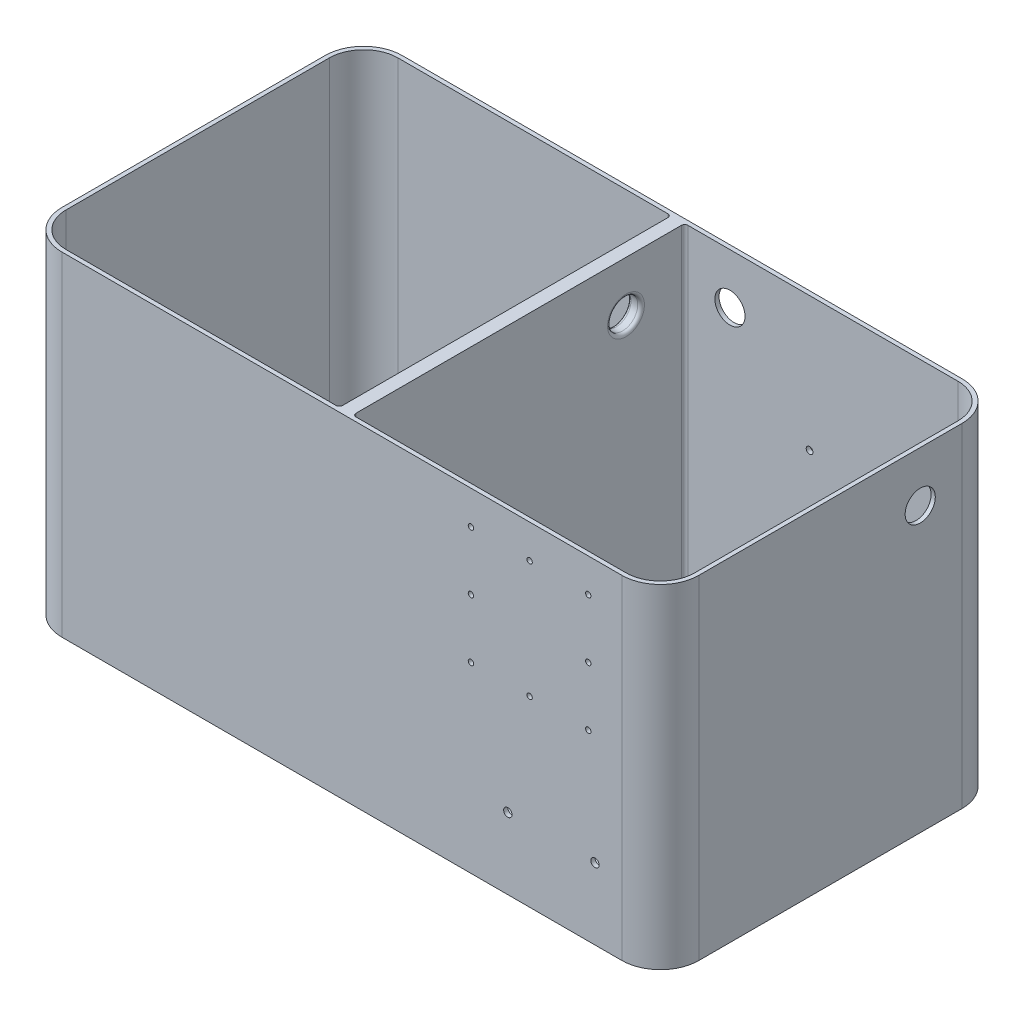
from build123d import *

# Parameters (mm, degrees)
EXTRUDE_1_DEPTH     = 199
CUT_EXTRUDE_1_DEPTH = 195
SKETCH_4_W          = 8
SKETCH_4_H          = 198
EXTRUDE_2_DEPTH     = 195
FILLET_1_R          = 2
CUT_EXTRUDE_2_REACH = 343.921
SKETCH_6_R          = 2
SKETCH_6_R_2        = 9
CUT_EXTRUDE_3_REACH = 297.87
SKETCH_7_R          = 9
FILLET_2_R          = 2
CUT_EXTRUDE_4_REACH = 442.798
SKETCH_9_R          = 9
CUT_EXTRUDE_5_REACH = 343.921
SKETCH_11_R         = 1.6
CUT_EXTRUDE_6_REACH = 343.921
SKETCH_12_R         = 1.6
CUT_EXTRUDE_7_REACH = 343.921
SKETCH_13_R         = 2.5


with BuildPart() as part:
    # 草图1 → 凸台-拉伸1 (new body)
    with BuildSketch(Plane(origin=(0, 0, 0), x_dir=(1, 0, 0), z_dir=(0, 1, 0))):
        with BuildLine():
            Line((-167, 101.5), (167, 101.5))
            ThreePointArc((167, 101.5), (183.263455967, 94.763455967), (190, 78.5))
            Line((190, 78.5), (190, -78.5))
            ThreePointArc((190, -78.5), (183.263455967, -94.763455967), (167, -101.5))
            Line((167, -101.5), (-167, -101.5))
            ThreePointArc((-167, -101.5), (-183.263455967, -94.763455967), (-190, -78.5))
            Line((-190, -78.5), (-190, 78.5))
            ThreePointArc((-190, 78.5), (-183.263455967, 94.763455967), (-167, 101.5))
        make_face()
    extrude(amount=EXTRUDE_1_DEPTH)

    # 草图3 → 切除-拉伸1 (cut)
    with BuildSketch(Plane(origin=(0, 199, 0), x_dir=(1, 0, 0), z_dir=(0, 1, 0))):
        with BuildLine():
            Line((-167, 99), (167, 99))
            ThreePointArc((167, 99), (181.495689014, 92.995689014), (187.5, 78.5))
            Line((187.5, 78.5), (187.5, -78.5))
            ThreePointArc((187.5, -78.5), (181.495689014, -92.995689014), (167, -99))
            Line((167, -99), (-167, -99))
            ThreePointArc((-167, -99), (-181.495689014, -92.995689014), (-187.5, -78.5))
            Line((-187.5, -78.5), (-187.5, 78.5))
            ThreePointArc((-187.5, 78.5), (-181.495689014, 92.995689014), (-167, 99))
        make_face()
    extrude(amount=-CUT_EXTRUDE_1_DEPTH, mode=Mode.SUBTRACT)

    # 草图4 → 凸台-拉伸2 (add)
    with BuildSketch(Plane(origin=(0, 4, 0), x_dir=(1, 0, 0), z_dir=(0, 1, 0))):
        Rectangle(SKETCH_4_W, SKETCH_4_H)
    extrude(amount=EXTRUDE_2_DEPTH)

    # 圆角1
    fillet_1_edges = [part.edges().sort_by_distance(p)[0] for p in [
        (-181.495689014, 4, 92.995689014),
        (-187.5, 4, 0),
        (-181.495689014, 4, -92.995689014),
        (85.5, 4, -99),
        (181.495689014, 4, -92.995689014),
        (187.5, 4, 0),
        (181.495689014, 4, 92.995689014),
        (-85.5, 4, 99),
        (85.5, 4, 99),
        (-85.5, 4, -99),
        (4, 101.5, -99),
        (-4, 4, 0),
        (-4, 101.5, -99),
        (-4, 101.5, 99),
        (4, 4, 0),
        (4, 101.5, 99),
    ]]
    fillet(fillet_1_edges, radius=FILLET_1_R)

    # 草图6 → 切除-拉伸2 (cut, up to next)
    with BuildSketch(Plane(origin=(0, 0, -101.5), x_dir=(-1, 0, 0), z_dir=(0, 0, -1)), mode=Mode.PRIVATE) as cut_extrude_2_sk1:
        with Locations((-155, 119)):
            Circle(SKETCH_6_R)
    cut_extrude_2_tool1 = extrude(cut_extrude_2_sk1.sketch, amount=-CUT_EXTRUDE_2_REACH, mode=Mode.PRIVATE) & part.part
    # 草图6 → 切除-拉伸2 (cut, up to next)
    with BuildSketch(Plane(origin=(0, 0, -101.5), x_dir=(-1, 0, 0), z_dir=(0, 0, -1)), mode=Mode.PRIVATE) as cut_extrude_2_sk2:
        with Locations((-155, 64)):
            Circle(SKETCH_6_R)
    cut_extrude_2_tool2 = extrude(cut_extrude_2_sk2.sketch, amount=-CUT_EXTRUDE_2_REACH, mode=Mode.PRIVATE) & part.part
    # 草图6 → 切除-拉伸2 (cut, up to next)
    with BuildSketch(Plane(origin=(0, 0, -101.5), x_dir=(-1, 0, 0), z_dir=(0, 0, -1)), mode=Mode.PRIVATE) as cut_extrude_2_sk3:
        with Locations((-78.5, 64)):
            Circle(SKETCH_6_R)
    cut_extrude_2_tool3 = extrude(cut_extrude_2_sk3.sketch, amount=-CUT_EXTRUDE_2_REACH, mode=Mode.PRIVATE) & part.part
    # 草图6 → 切除-拉伸2 (cut, up to next)
    with BuildSketch(Plane(origin=(0, 0, -101.5), x_dir=(-1, 0, 0), z_dir=(0, 0, -1)), mode=Mode.PRIVATE) as cut_extrude_2_sk4:
        with Locations((-78.5, 119)):
            Circle(SKETCH_6_R)
    cut_extrude_2_tool4 = extrude(cut_extrude_2_sk4.sketch, amount=-CUT_EXTRUDE_2_REACH, mode=Mode.PRIVATE) & part.part
    # 草图6 → 切除-拉伸2 (cut, up to next)
    with BuildSketch(Plane(origin=(0, 0, -101.5), x_dir=(-1, 0, 0), z_dir=(0, 0, -1)), mode=Mode.PRIVATE) as cut_extrude_2_sk5:
        with Locations((-31, 169)):
            Circle(SKETCH_6_R_2)
    cut_extrude_2_tool5 = extrude(cut_extrude_2_sk5.sketch, amount=-CUT_EXTRUDE_2_REACH, mode=Mode.PRIVATE) & part.part
    add(cut_extrude_2_tool1.solids().sort_by_distance((155, 119, -101.5))[0], mode=Mode.SUBTRACT)
    add(cut_extrude_2_tool2.solids().sort_by_distance((155, 64, -101.5))[0], mode=Mode.SUBTRACT)
    add(cut_extrude_2_tool3.solids().sort_by_distance((78.5, 64, -101.5))[0], mode=Mode.SUBTRACT)
    add(cut_extrude_2_tool4.solids().sort_by_distance((78.5, 119, -101.5))[0], mode=Mode.SUBTRACT)
    add(cut_extrude_2_tool5.solids().sort_by_distance((31, 169, -101.5))[0], mode=Mode.SUBTRACT)

    # 草图7 → 切除-拉伸3 (cut, up to next)
    with BuildSketch(Plane(origin=(4, 0, 0), x_dir=(0, 0, -1), z_dir=(1, 0, 0)), mode=Mode.PRIVATE) as cut_extrude_3_sk1:
        with Locations((64, 169)):
            Circle(SKETCH_7_R)
    cut_extrude_3_tool1 = extrude(cut_extrude_3_sk1.sketch, amount=-CUT_EXTRUDE_3_REACH, mode=Mode.PRIVATE) & part.part
    add(cut_extrude_3_tool1.solids().sort_by_distance((4, 169, -64))[0], mode=Mode.SUBTRACT)

    # 圆角2
    fillet_2_edges = [part.edges().sort_by_distance(p)[0] for p in [
        (-4, 169, -55),
        (4, 169, -55),
    ]]
    fillet(fillet_2_edges, radius=FILLET_2_R)

    # 草图9 → 切除-拉伸4 (cut, up to next)
    with BuildSketch(Plane(origin=(190, 0, 0), x_dir=(0, 0, -1), z_dir=(1, 0, 0)), mode=Mode.PRIVATE) as cut_extrude_4_sk1:
        with Locations((53.5, 169)):
            Circle(SKETCH_9_R)
    cut_extrude_4_tool1 = extrude(cut_extrude_4_sk1.sketch, amount=-CUT_EXTRUDE_4_REACH, mode=Mode.PRIVATE) & part.part
    add(cut_extrude_4_tool1.solids().sort_by_distance((190, 169, -53.5))[0], mode=Mode.SUBTRACT)

    # 草图11 → 切除-拉伸5 (cut, up to next)
    with BuildSketch(Plane.XY.offset(101.5), mode=Mode.PRIVATE) as cut_extrude_5_sk1:
        with Locations((77, 179)):
            Circle(SKETCH_11_R)
    cut_extrude_5_tool1 = extrude(cut_extrude_5_sk1.sketch, amount=-CUT_EXTRUDE_5_REACH, mode=Mode.PRIVATE) & part.part
    # 草图11 → 切除-拉伸5 (cut, up to next)
    with BuildSketch(Plane.XY.offset(101.5), mode=Mode.PRIVATE) as cut_extrude_5_sk2:
        with Locations((147, 179)):
            Circle(SKETCH_11_R)
    cut_extrude_5_tool2 = extrude(cut_extrude_5_sk2.sketch, amount=-CUT_EXTRUDE_5_REACH, mode=Mode.PRIVATE) & part.part
    # 草图11 → 切除-拉伸5 (cut, up to next)
    with BuildSketch(Plane.XY.offset(101.5), mode=Mode.PRIVATE) as cut_extrude_5_sk3:
        with Locations((77, 109)):
            Circle(SKETCH_11_R)
    cut_extrude_5_tool3 = extrude(cut_extrude_5_sk3.sketch, amount=-CUT_EXTRUDE_5_REACH, mode=Mode.PRIVATE) & part.part
    # 草图11 → 切除-拉伸5 (cut, up to next)
    with BuildSketch(Plane.XY.offset(101.5), mode=Mode.PRIVATE) as cut_extrude_5_sk4:
        with Locations((147, 109)):
            Circle(SKETCH_11_R)
    cut_extrude_5_tool4 = extrude(cut_extrude_5_sk4.sketch, amount=-CUT_EXTRUDE_5_REACH, mode=Mode.PRIVATE) & part.part
    add(cut_extrude_5_tool1.solids().sort_by_distance((77, 179, 101.5))[0], mode=Mode.SUBTRACT)
    add(cut_extrude_5_tool2.solids().sort_by_distance((147, 179, 101.5))[0], mode=Mode.SUBTRACT)
    add(cut_extrude_5_tool3.solids().sort_by_distance((77, 109, 101.5))[0], mode=Mode.SUBTRACT)
    add(cut_extrude_5_tool4.solids().sort_by_distance((147, 109, 101.5))[0], mode=Mode.SUBTRACT)

    # 草图12 → 切除-拉伸6 (cut, up to next)
    with BuildSketch(Plane.XY.offset(101.5), mode=Mode.PRIVATE) as cut_extrude_6_sk1:
        with Locations((77, 144)):
            Circle(SKETCH_12_R)
    cut_extrude_6_tool1 = extrude(cut_extrude_6_sk1.sketch, amount=-CUT_EXTRUDE_6_REACH, mode=Mode.PRIVATE) & part.part
    # 草图12 → 切除-拉伸6 (cut, up to next)
    with BuildSketch(Plane.XY.offset(101.5), mode=Mode.PRIVATE) as cut_extrude_6_sk2:
        with Locations((112, 179)):
            Circle(SKETCH_12_R)
    cut_extrude_6_tool2 = extrude(cut_extrude_6_sk2.sketch, amount=-CUT_EXTRUDE_6_REACH, mode=Mode.PRIVATE) & part.part
    # 草图12 → 切除-拉伸6 (cut, up to next)
    with BuildSketch(Plane.XY.offset(101.5), mode=Mode.PRIVATE) as cut_extrude_6_sk3:
        with Locations((147, 144)):
            Circle(SKETCH_12_R)
    cut_extrude_6_tool3 = extrude(cut_extrude_6_sk3.sketch, amount=-CUT_EXTRUDE_6_REACH, mode=Mode.PRIVATE) & part.part
    # 草图12 → 切除-拉伸6 (cut, up to next)
    with BuildSketch(Plane.XY.offset(101.5), mode=Mode.PRIVATE) as cut_extrude_6_sk4:
        with Locations((112, 109)):
            Circle(SKETCH_12_R)
    cut_extrude_6_tool4 = extrude(cut_extrude_6_sk4.sketch, amount=-CUT_EXTRUDE_6_REACH, mode=Mode.PRIVATE) & part.part
    add(cut_extrude_6_tool1.solids().sort_by_distance((77, 144, 101.5))[0], mode=Mode.SUBTRACT)
    add(cut_extrude_6_tool2.solids().sort_by_distance((112, 179, 101.5))[0], mode=Mode.SUBTRACT)
    add(cut_extrude_6_tool3.solids().sort_by_distance((147, 144, 101.5))[0], mode=Mode.SUBTRACT)
    add(cut_extrude_6_tool4.solids().sort_by_distance((112, 109, 101.5))[0], mode=Mode.SUBTRACT)

    # 草图13 → 切除-拉伸7 (cut, up to next)
    with BuildSketch(Plane.XY.offset(101.5), mode=Mode.PRIVATE) as cut_extrude_7_sk1:
        with Locations((99, 42.5)):
            Circle(SKETCH_13_R)
    cut_extrude_7_tool1 = extrude(cut_extrude_7_sk1.sketch, amount=-CUT_EXTRUDE_7_REACH, mode=Mode.PRIVATE) & part.part
    # 草图13 → 切除-拉伸7 (cut, up to next)
    with BuildSketch(Plane.XY.offset(101.5), mode=Mode.PRIVATE) as cut_extrude_7_sk2:
        with Locations((151, 42.5)):
            Circle(SKETCH_13_R)
    cut_extrude_7_tool2 = extrude(cut_extrude_7_sk2.sketch, amount=-CUT_EXTRUDE_7_REACH, mode=Mode.PRIVATE) & part.part
    add(cut_extrude_7_tool1.solids().sort_by_distance((99, 42.5, 101.5))[0], mode=Mode.SUBTRACT)
    add(cut_extrude_7_tool2.solids().sort_by_distance((151, 42.5, 101.5))[0], mode=Mode.SUBTRACT)


solid = part.part
